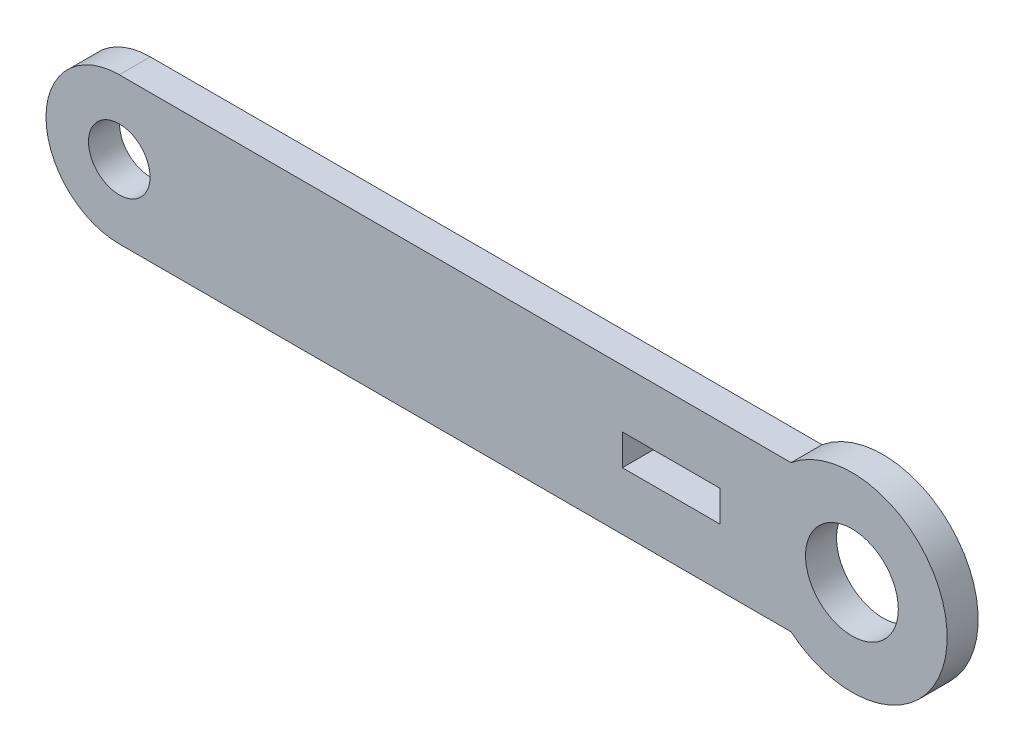
from build123d import *

# Parameters (mm, degrees)
SKETCH1_R           = 3.15
SKETCH1_R_2         = 4.75
BOSS_EXTRUDE1_DEPTH = 3.175
SKETCH2_W           = 15
SKETCH2_H           = 3.175
SKETCH2_W_2         = 10
CUT_EXTRUDE1_DEPTH  = 49.349825491
SKETCH4_W           = 20.014244063
SKETCH4_H           = 7.260981568
BOSS_EXTRUDE2_DEPTH = 3.175


with BuildPart() as part:
    # Sketch1 → Boss-Extrude1 (new body)
    with BuildSketch(Plane.XY):
        with BuildLine():
            Line((-37.5, -7.5), (31.270032103, -7.5))
            ThreePointArc((31.270032103, -7.5), (47.25, 0), (31.270032103, 7.5))
            Line((31.270032103, 7.5), (-37.5, 7.5))
            ThreePointArc((-37.5, 7.5), (-45, 0), (-37.5, -7.5))
        make_face()
        with Locations((-37.5, 0)):
            Circle(SKETCH1_R, mode=Mode.SUBTRACT)
        with Locations((37.5, 0)):
            Circle(SKETCH1_R_2, mode=Mode.SUBTRACT)
    extrude(amount=BOSS_EXTRUDE1_DEPTH)

    # Sketch2 → Cut-Extrude1 (cut, through all)
    with BuildSketch(Plane.XY.offset(3.175)):
        with Locations((-17.5, 0)):
            Rectangle(SKETCH2_W, SKETCH2_H)
        with Locations((19, 0)):
            Rectangle(SKETCH2_W_2, SKETCH2_H)
    extrude(amount=-CUT_EXTRUDE1_DEPTH, mode=Mode.SUBTRACT)

    # Sketch4 → Boss-Extrude2 (add)
    with BuildSketch(Plane.XY.offset(3.175)):
        with Locations((-17.454282614, 0)):
            Rectangle(SKETCH4_W, SKETCH4_H)
    extrude(amount=-BOSS_EXTRUDE2_DEPTH)


solid = part.part
